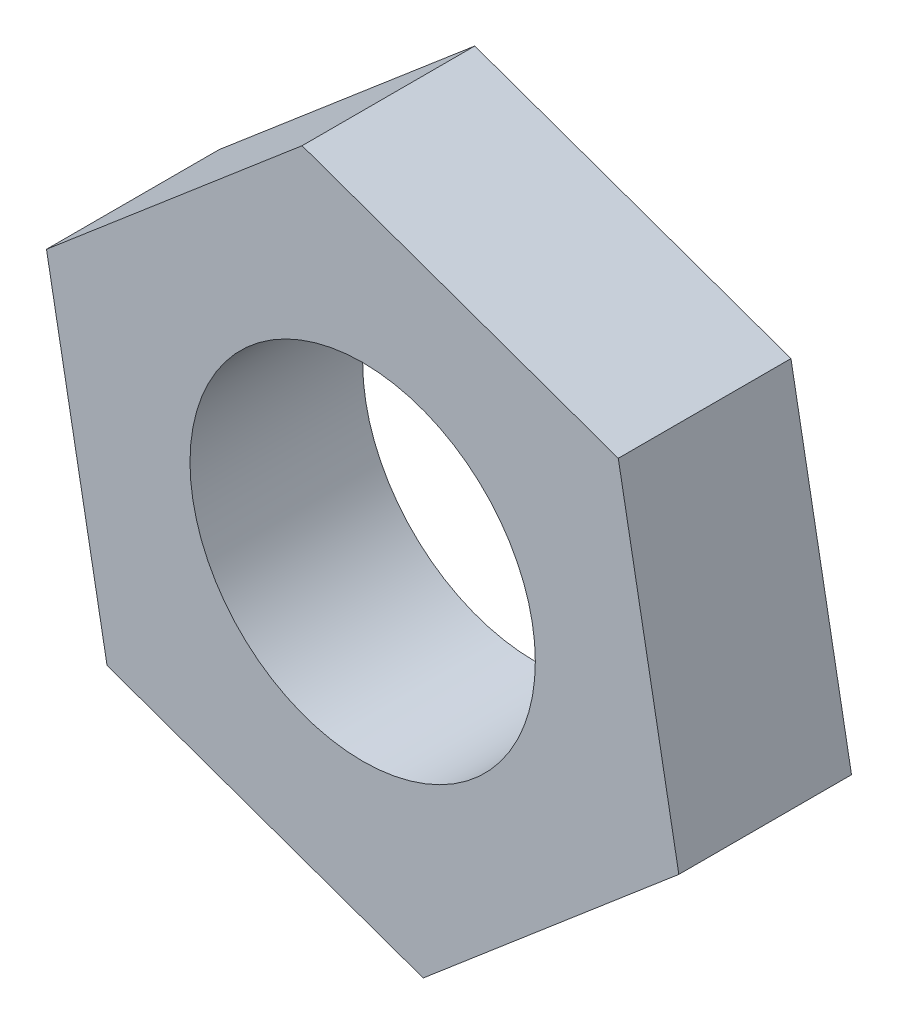
from build123d import *

# Parameters (mm, degrees)
SKETCH1_R           = 3
BOSS_EXTRUDE1_DEPTH = 3


with BuildPart() as part:
    # Sketch1 → Boss-Extrude1 (new body)
    # profile 1 of 7: a face of its own
    with BuildSketch(Plane.XY):
        with BuildLine():
            ThreePointArc((1328.13150473, -1693.072432874), (1328.496972448, -1691.186259901), (1328.13150473, -1689.300086927))
            Line((1328.13150473, -1689.300086927), (1327.422718332, -1688.072432874))
            ThreePointArc((1327.422718332, -1688.072432874), (1325.97197848, -1686.812842059), (1324.15577091, -1686.186259901))
            Line((1324.15577091, -1686.186259901), (1322.738198114, -1686.186259901))
            ThreePointArc((1322.738198114, -1686.186259901), (1320.921990544, -1686.812842059), (1319.471250692, -1688.072432874))
            Line((1319.471250692, -1688.072432874), (1318.762464294, -1689.300086927))
            ThreePointArc((1318.762464294, -1689.300086927), (1318.396996575, -1691.186259901), (1318.762464294, -1693.072432874))
            Line((1318.762464294, -1693.072432874), (1319.471250692, -1694.300086927))
            ThreePointArc((1319.471250692, -1694.300086927), (1320.921990544, -1695.559677742), (1322.738198114, -1696.186259901))
            Line((1322.738198114, -1696.186259901), (1324.15577091, -1696.186259901))
            ThreePointArc((1324.15577091, -1696.186259901), (1325.97197848, -1695.559677742), (1327.422718332, -1694.300086927))
            Line((1327.422718332, -1694.300086927), (1328.13150473, -1693.072432874))
        make_face()
        with Locations((1323.446984512, -1691.186259901)):
            Circle(SKETCH1_R, mode=Mode.SUBTRACT)
    # profile 2 of 7: a face of its own
    with BuildSketch(Plane.XY):
        with BuildLine():
            Line((1321.752495925, -1695.943474063), (1324.499074459, -1696.921787568))
            Line((1324.499074459, -1696.921787568), (1326.719608123, -1695.032337494))
            ThreePointArc((1326.719608123, -1695.032337494), (1325.519613433, -1695.791320976), (1324.15577091, -1696.186259901))
            Line((1324.15577091, -1696.186259901), (1322.738198114, -1696.186259901))
            ThreePointArc((1322.738198114, -1696.186259901), (1322.239230852, -1696.089698414), (1321.752495925, -1695.943474063))
        make_face()
    # profile 3 of 7: a face of its own
    with BuildSketch(Plane.XY):
        with BuildLine():
            ThreePointArc((1327.422718332, -1694.300086927), (1327.089609813, -1694.683924703), (1326.719608123, -1695.032337494))
            Line((1326.719608123, -1695.032337494), (1328.940142149, -1693.142887113))
            Line((1328.940142149, -1693.142887113), (1328.414095773, -1690.275115635))
            ThreePointArc((1328.414095773, -1690.275115635), (1328.471399253, -1691.693837156), (1328.13150473, -1693.072432874))
            Line((1328.13150473, -1693.072432874), (1327.422718332, -1694.300086927))
        make_face()
    # profile 4 of 7: a face of its own
    with BuildSketch(Plane.XY):
        with BuildLine():
            ThreePointArc((1328.13150473, -1689.300086927), (1328.297362621, -1689.780482408), (1328.414095773, -1690.275115635))
            Line((1328.414095773, -1690.275115635), (1327.888052202, -1687.407359446))
            Line((1327.888052202, -1687.407359446), (1325.141464891, -1686.429042814))
            ThreePointArc((1325.141464891, -1686.429042814), (1326.398766175, -1687.08877736), (1327.422718332, -1688.072432874))
            Line((1327.422718332, -1688.072432874), (1328.13150473, -1689.300086927))
        make_face()
    # profile 5 of 7: a face of its own
    with BuildSketch(Plane.XY):
        with BuildLine():
            ThreePointArc((1324.15577091, -1686.186259901), (1324.654733942, -1686.282820345), (1325.141464891, -1686.429042814))
            Line((1325.141464891, -1686.429042814), (1322.394894565, -1685.450732233))
            Line((1322.394894565, -1685.450732233), (1320.17435296, -1687.340189064))
            ThreePointArc((1320.17435296, -1687.340189064), (1321.374350836, -1686.581200964), (1322.738198114, -1686.186259901))
            Line((1322.738198114, -1686.186259901), (1324.15577091, -1686.186259901))
        make_face()
    # profile 6 of 7: a face of its own
    with BuildSketch(Plane.XY):
        with BuildLine():
            Line((1317.953826874, -1689.229632688), (1318.479872929, -1692.097402415))
            ThreePointArc((1318.479872929, -1692.097402415), (1318.42256986, -1690.67868176), (1318.762464294, -1689.300086927))
            Line((1318.762464294, -1689.300086927), (1319.471250692, -1688.072432874))
            ThreePointArc((1319.471250692, -1688.072432874), (1319.8043556, -1687.688598858), (1320.17435296, -1687.340189064))
            Line((1320.17435296, -1687.340189064), (1317.953826874, -1689.229632688))
        make_face()
    # profile 7 of 7: a face of its own
    with BuildSketch(Plane.XY):
        with BuildLine():
            Line((1319.005916822, -1694.965160355), (1321.752495925, -1695.943474063))
            ThreePointArc((1321.752495925, -1695.943474063), (1320.495199314, -1695.283739895), (1319.471250692, -1694.300086927))
            Line((1319.471250692, -1694.300086927), (1318.762464294, -1693.072432874))
            ThreePointArc((1318.762464294, -1693.072432874), (1318.596606155, -1692.592036538), (1318.479872929, -1692.097402415))
            Line((1318.479872929, -1692.097402415), (1319.005916822, -1694.965160355))
        make_face()
    extrude(amount=BOSS_EXTRUDE1_DEPTH)


solid = part.part
